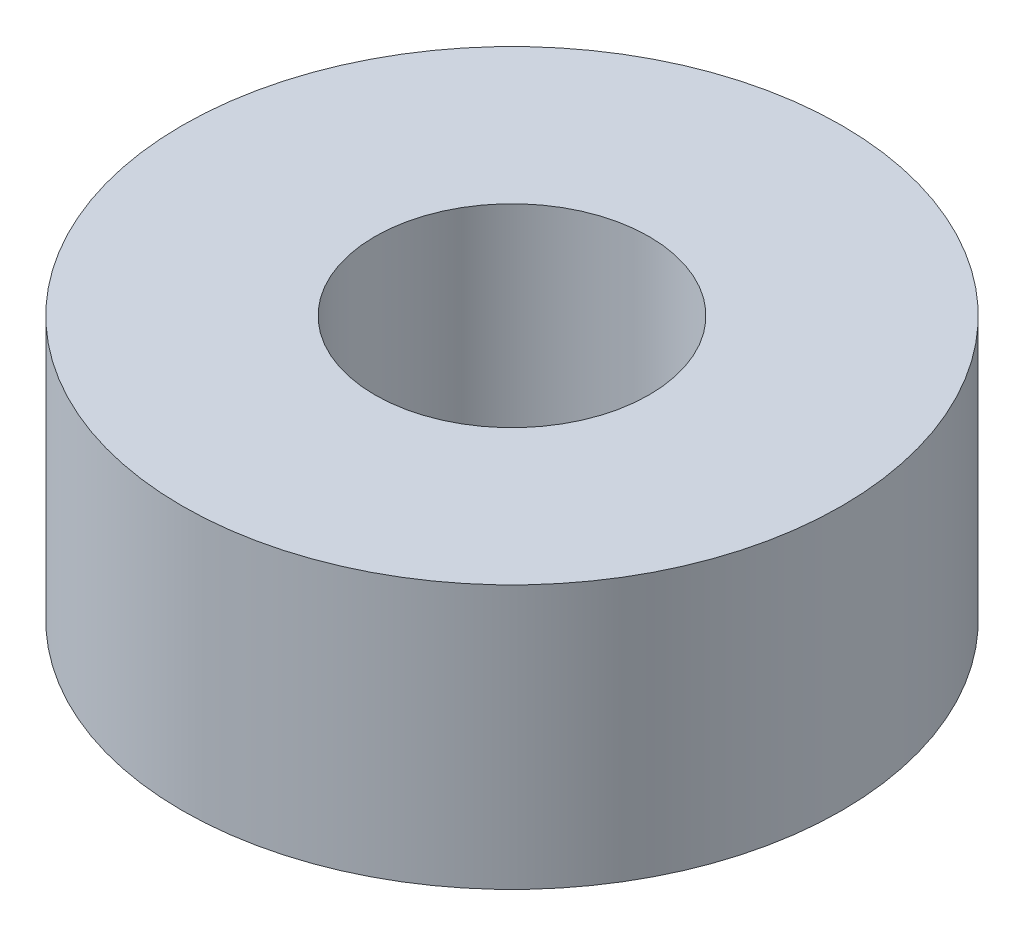
from build123d import *

# Parameters (mm, degrees)
SKETCH1_R           = 7.9375
SKETCH1_R_2         = 3.302
BOSS_EXTRUDE1_DEPTH = 6.35


with BuildPart() as part:
    # Sketch1 → Boss-Extrude1 (new body)
    with BuildSketch(Plane(origin=(0, 0, 0), x_dir=(1, 0, 0), z_dir=(0, 1, 0))):
        with Locations(Location((0, 0, 0), (0, 0, 270))):
            Circle(SKETCH1_R)
        with Locations(Location((0, 0, 0), (0, 0, 270))):
            Circle(SKETCH1_R_2, mode=Mode.SUBTRACT)
    extrude(amount=BOSS_EXTRUDE1_DEPTH)


solid = part.part
